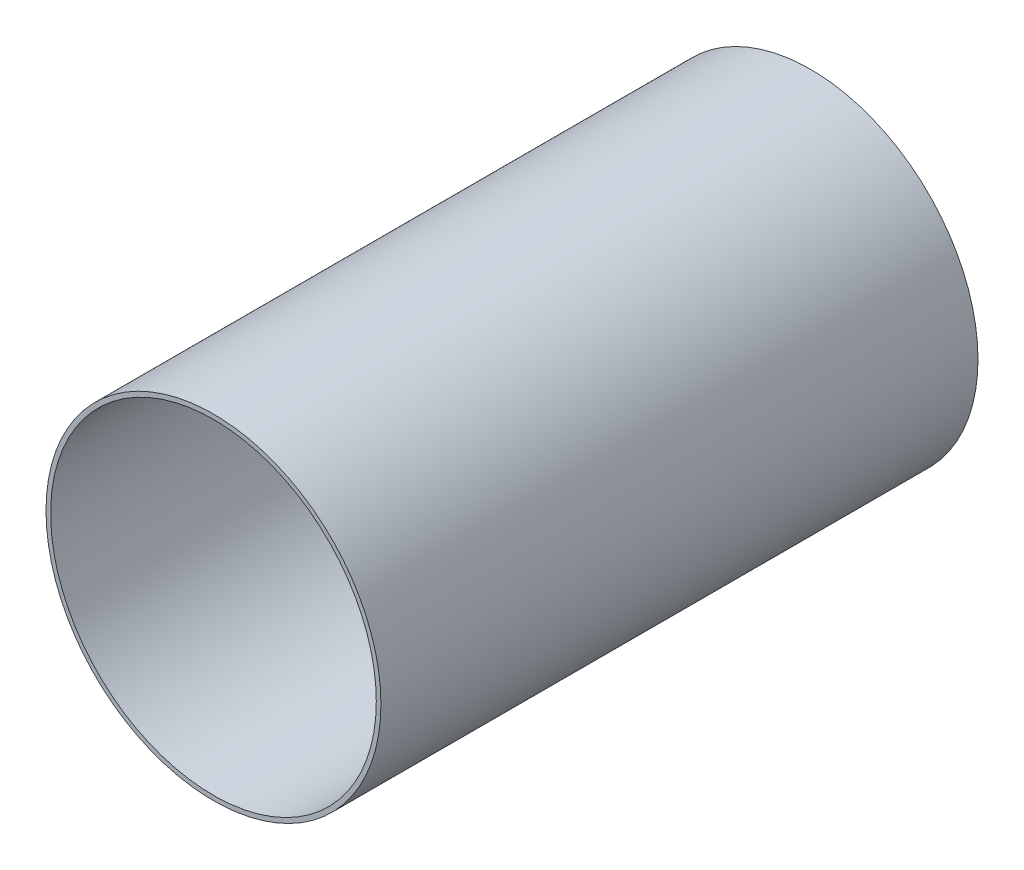
from build123d import *

# Parameters (mm, degrees)
ESQUISSE2_R        = 78.359
ESQUISSE2_R_2      = 76.2
BOSS_EXTRU_1_DEPTH = 279.4


with BuildPart() as part:
    # Esquisse2 → Boss.-Extru.1 (new body)
    with BuildSketch(Plane.XY):
        Circle(ESQUISSE2_R)
        Circle(ESQUISSE2_R_2, mode=Mode.SUBTRACT)
    extrude(amount=BOSS_EXTRU_1_DEPTH)


solid = part.part
